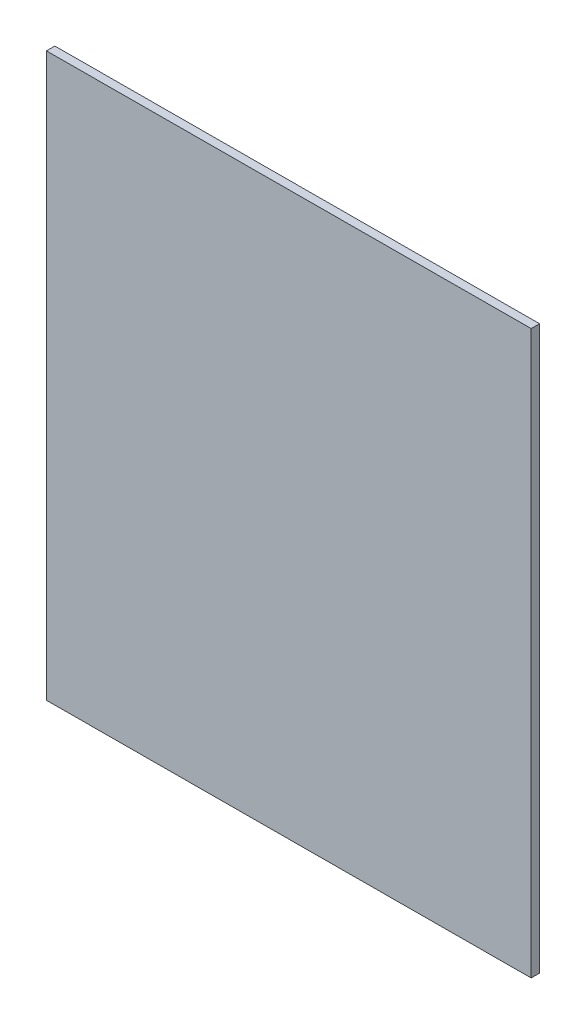
from build123d import *

# Parameters (mm, degrees)
SKETCH2_W           = 115.045868552
SKETCH2_H           = 134
BOSS_EXTRUDE1_DEPTH = 2


with BuildPart() as part:
    # Sketch2 → Boss-Extrude1 (new body)
    with BuildSketch(Plane(origin=(-0.085307959, 0, -21.997693667), x_dir=(0.9999924804836269, 0, -0.003878011887969731), z_dir=(0.003878011887969731, 0, 0.9999924804836269))):
        with Locations((0, 325.864031922)):
            Rectangle(SKETCH2_W, SKETCH2_H)
    extrude(amount=BOSS_EXTRUDE1_DEPTH)


solid = part.part
